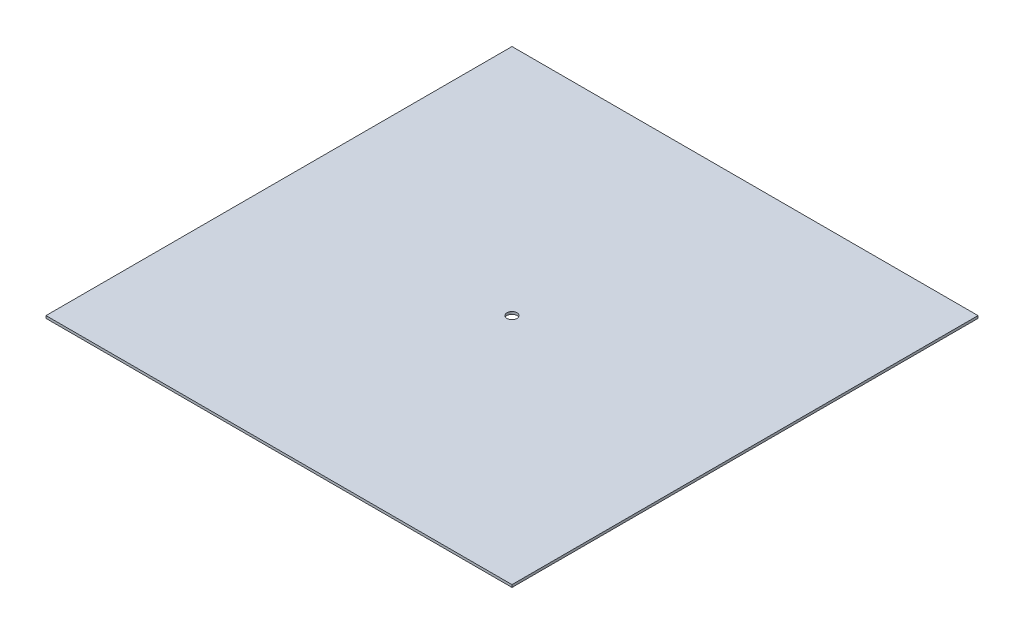
from build123d import *

# Parameters (mm, degrees)
SKETCH1_W               = 304.8
SKETCH1_H               = 304.8
BOSS_EXTRUDE1_DEPTH     = 1.6256
F_1_4_CLEARANCE_HOLE1_D = 6.5278


with BuildPart() as part:
    # Sketch1 → Boss-Extrude1 (new body)
    with BuildSketch(Plane(origin=(0, 0, 0), x_dir=(1, 0, 0), z_dir=(0, 1, 0))):
        Rectangle(SKETCH1_W, SKETCH1_H)
    extrude(amount=BOSS_EXTRUDE1_DEPTH)

    # 1/4 Clearance Hole1 (through all)
    with Locations(Plane(origin=(0, 1.6256, 0), x_dir=(1, 0, 0), z_dir=(0, 1, 0))):
        with Locations((0, 0)):
            Hole(F_1_4_CLEARANCE_HOLE1_D / 2)


solid = part.part
